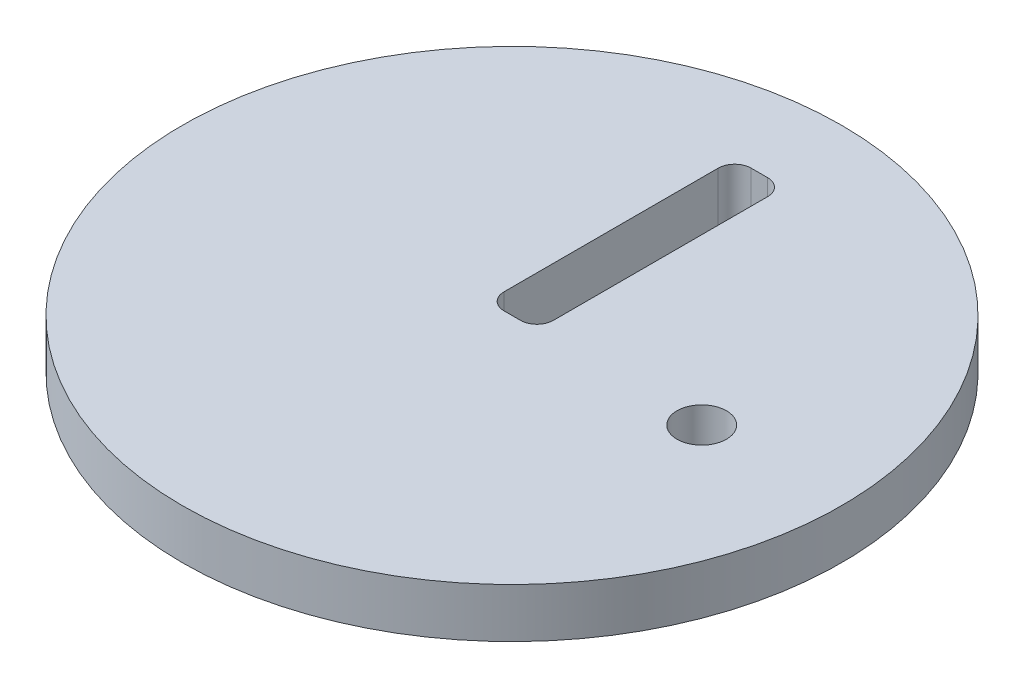
from build123d import *

# Parameters (mm, degrees)
SKETCH1_R           = 20
BOSS_EXTRUDE1_DEPTH = 3
SKETCH2_W           = 3
SKETCH2_H           = 15
CUT_EXTRUDE1_DEPTH  = 3
SKETCH3_R           = 1.5
CUT_EXTRUDE2_DEPTH  = 3
FILLET1_R           = 1
FILLET2_R           = 1
FILLET3_R           = 1
FILLET4_R           = 1


with BuildPart() as part:
    # Sketch1 → Boss-Extrude1 (new body)
    with BuildSketch(Plane(origin=(0, 0, 0), x_dir=(1, 0, 0), z_dir=(0, 1, 0))):
        with Locations(Location((0, 0, 0), (0, 0, 270))):
            Circle(SKETCH1_R)
    extrude(amount=BOSS_EXTRUDE1_DEPTH)

    # Sketch2 → Cut-Extrude1 (cut)
    with BuildSketch(Plane(origin=(0, 3, 0), x_dir=(1, 0, 0), z_dir=(0, 1, 0))):
        with Locations((0.013912119, 7.5)):
            Rectangle(SKETCH2_W, SKETCH2_H)
    extrude(amount=-CUT_EXTRUDE1_DEPTH, mode=Mode.SUBTRACT)

    # Sketch3 → Cut-Extrude2 (cut)
    with BuildSketch(Plane(origin=(0, 3, 0), x_dir=(1, 0, 0), z_dir=(0, 1, 0))):
        with Locations(Location((11.513912119, 0, 0), (0, 0, 270))):
            Circle(SKETCH3_R)
    extrude(amount=-CUT_EXTRUDE2_DEPTH, mode=Mode.SUBTRACT)

    # Fillet1
    fillet1_edges = [part.edges().sort_by_distance(p)[0] for p in [
        (-1.486087881, 1.5, -15),
    ]]
    fillet(fillet1_edges, radius=FILLET1_R)

    # Fillet2
    fillet2_edges = [part.edges().sort_by_distance(p)[0] for p in [
        (1.513912119, 1.5, -15),
    ]]
    fillet(fillet2_edges, radius=FILLET2_R)

    # Fillet3
    fillet3_edges = [part.edges().sort_by_distance(p)[0] for p in [
        (-1.486087881, 1.5, 0),
    ]]
    fillet(fillet3_edges, radius=FILLET3_R)

    # Fillet4
    fillet4_edges = [part.edges().sort_by_distance(p)[0] for p in [
        (1.513912119, 1.5, 0),
    ]]
    fillet(fillet4_edges, radius=FILLET4_R)


solid = part.part
